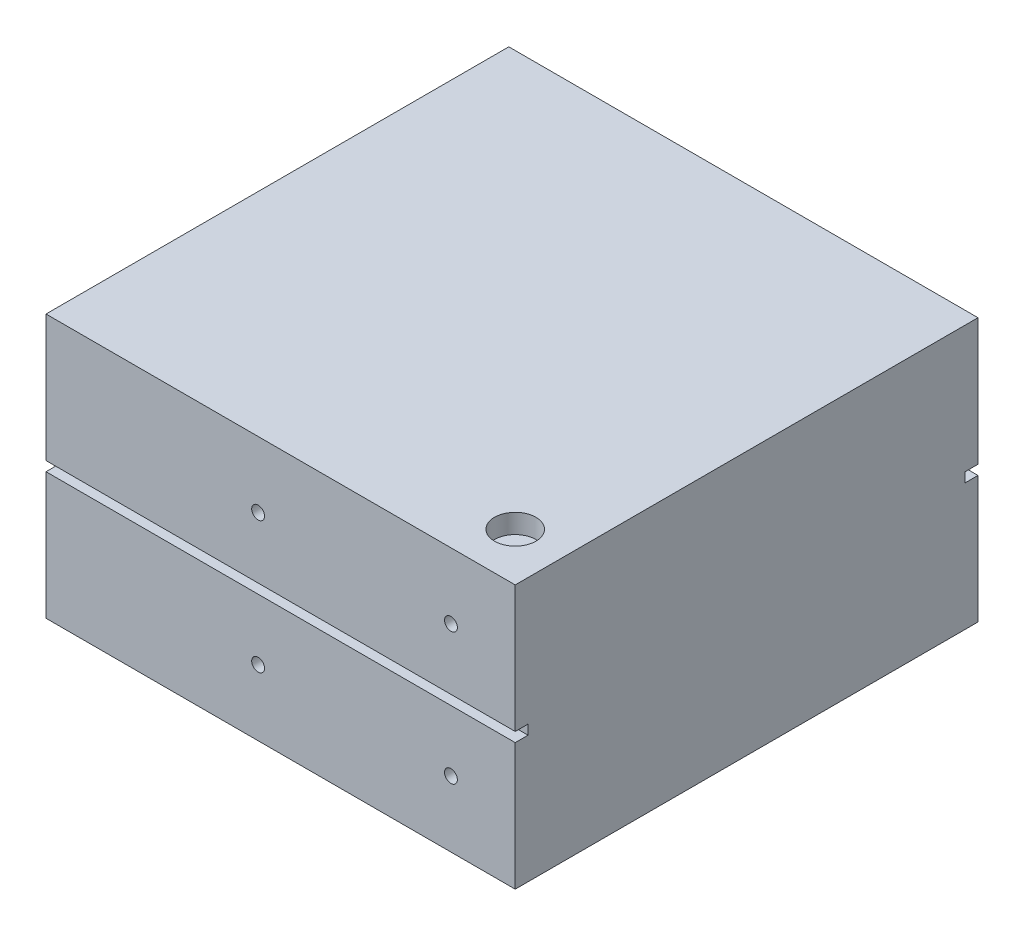
from build123d import *

# Parameters (mm, degrees)
SKETCH1_W           = 146
SKETCH1_H           = 144
BOSS_EXTRUDE1_DEPTH = 82
SHELL1_T            = 6
SKETCH2_R           = 6.45
CUT_EXTRUDE1_DEPTH  = 10
SKETCH3_R           = 6.5
CUT_EXTRUDE2_DEPTH  = 5
SKETCH4_W           = 4
SKETCH4_H           = 3
CUT_EXTRUDE3_DEPTH  = 199.806250042
SKETCH5_R           = 2
CUT_EXTRUDE4_DEPTH  = 4
CUT_EXTRUDE5_START  = -4
SKETCH6_R           = 2
CUT_EXTRUDE5_DEPTH  = 4


with BuildPart() as part:
    # Sketch1 → Boss-Extrude1 (new body)
    with BuildSketch(Plane(origin=(0, 0, 0), x_dir=(1, 0, 0), z_dir=(0, 1, 0))):
        with Locations((16.396923077, -35.163076923)):
            Rectangle(SKETCH1_W, SKETCH1_H)
    extrude(amount=BOSS_EXTRUDE1_DEPTH)

    # Shell1 (no face opened: a closed hollow body)
    add(offset(amount=-SHELL1_T, mode=Mode.PRIVATE), mode=Mode.SUBTRACT)

    # Sketch2 → Cut-Extrude1 (cut)
    with BuildSketch(Plane(origin=(0, 82, 0), x_dir=(1, 0, 0), z_dir=(0, 1, 0))):
        with Locations(Location((74.396923077, -92.163076923, 0), (0, 0, 270))):
            Circle(SKETCH2_R)
    extrude(amount=-CUT_EXTRUDE1_DEPTH, mode=Mode.SUBTRACT)

    # Sketch3 → Cut-Extrude2 (cut)
    with BuildSketch(Plane.ZY.offset(56.603076923)):
        with Locations((87.163076923, 62)):
            Circle(SKETCH3_R)
        with Locations((-16.836923077, 20)):
            Circle(SKETCH3_R)
    extrude(amount=-CUT_EXTRUDE2_DEPTH, mode=Mode.SUBTRACT)

    # Sketch4 → Cut-Extrude3 (cut, through all)
    with BuildSketch(Plane.ZY.offset(56.603076923)):
        with Locations((-34.836923077, 41)):
            Rectangle(SKETCH4_W, SKETCH4_H)
        with Locations((105.163076923, 41)):
            Rectangle(SKETCH4_W, SKETCH4_H)
    extrude(amount=-CUT_EXTRUDE3_DEPTH, mode=Mode.SUBTRACT)

    # Sketch5 → Cut-Extrude4 (cut)
    with BuildSketch(Plane.XY.offset(107.163076923)):
        with Locations((69.396923077, 61.5)):
            Circle(SKETCH5_R)
        with Locations((9.396923077, 61.5)):
            Circle(SKETCH5_R)
        with Locations((9.396923077, 20.5)):
            Circle(SKETCH5_R)
        with Locations((69.396923077, 20.5)):
            Circle(SKETCH5_R)
    extrude(amount=-CUT_EXTRUDE4_DEPTH, mode=Mode.SUBTRACT)

    # Sketch6 → Cut-Extrude5 (cut)
    with BuildSketch(Plane(origin=(0, 0, -36.836923077), x_dir=(-1, 0, 0), z_dir=(0, 0, -1)).offset(CUT_EXTRUDE5_START)):
        with Locations(Location((-9.396923077, 61.5, 0), (0, 0, 180))):
            Circle(SKETCH6_R)
        with Locations(Location((-69.396923077, 61.5, 0), (0, 0, 180))):
            Circle(SKETCH6_R)
        with Locations(Location((-69.396923077, 20.5, 0), (0, 0, 180))):
            Circle(SKETCH6_R)
        with Locations(Location((-9.396923077, 20.5, 0), (0, 0, 180))):
            Circle(SKETCH6_R)
    extrude(amount=CUT_EXTRUDE5_DEPTH, mode=Mode.SUBTRACT)


solid = part.part
